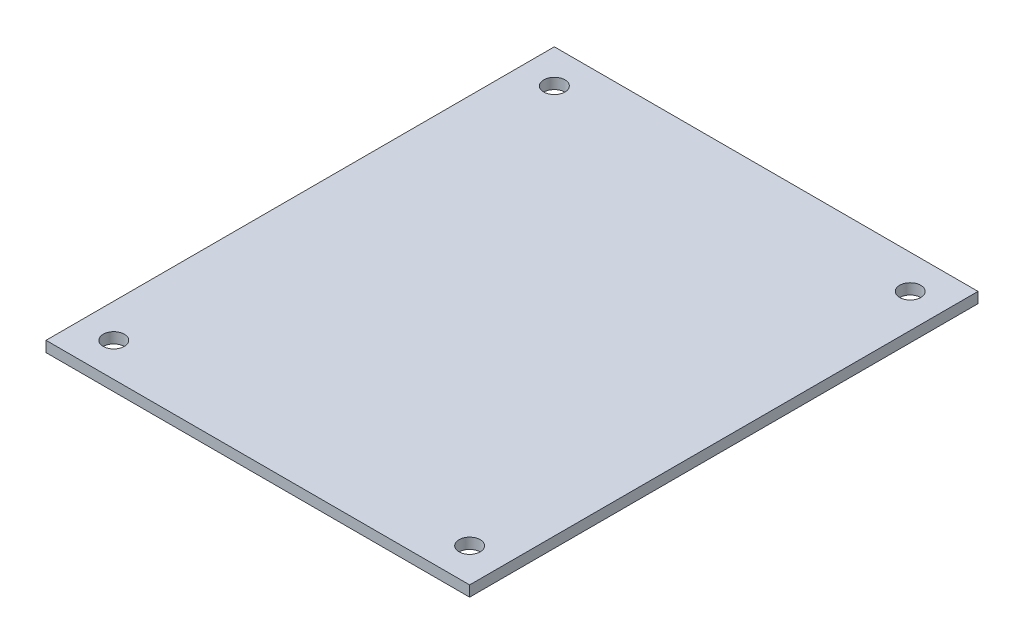
from build123d import *

# Parameters (mm, degrees)
SKETCH1_W           = 63.5
SKETCH1_H           = 76.2
SKETCH1_R           = 1.5875
BOSS_EXTRUDE1_DEPTH = 1.6


with BuildPart() as part:
    # Sketch1 → Boss-Extrude1 (new body)
    with BuildSketch(Plane(origin=(0, 0, 0), x_dir=(1, 0, 0), z_dir=(0, 1, 0))):
        with Locations((31.75, 38.1)):
            Rectangle(SKETCH1_W, SKETCH1_H)
        with Locations(Location((5.08, 5.08, 0), (0, 0, 270))):
            Circle(SKETCH1_R, mode=Mode.SUBTRACT)
        with Locations(Location((58.42, 5.08, 0), (0, 0, 270))):
            Circle(SKETCH1_R, mode=Mode.SUBTRACT)
        with Locations(Location((58.42, 71.12, 0), (0, 0, 270))):
            Circle(SKETCH1_R, mode=Mode.SUBTRACT)
        with Locations(Location((5.08, 71.12, 0), (0, 0, 270))):
            Circle(SKETCH1_R, mode=Mode.SUBTRACT)
    extrude(amount=BOSS_EXTRUDE1_DEPTH)


solid = part.part
